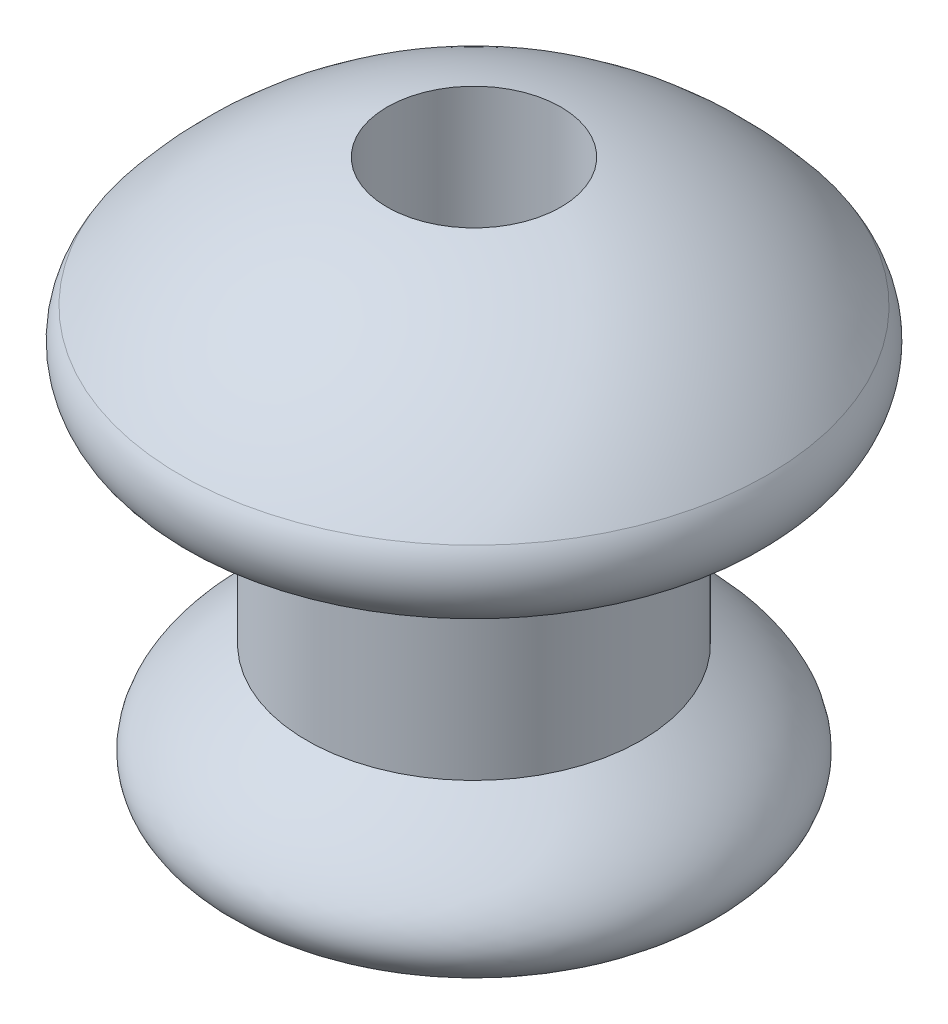
from build123d import *

# Parameters (mm, degrees)
SKETCH2_R          = 1
CUT_EXTRUDE2_DEPTH = 9.513842467


with BuildPart() as part:
    # Sketch1 → Revolve1 (revolve)
    with BuildSketch(Plane.XY):
        with BuildLine():
            add(Edge.make_bspline(
                [(1.901469747, -4.187890833), (3.997803393, -5.505352851), (2.40138715, -6.003675185), (0.316595481, -6.158045679)],
                knots=[0, 0, 0, 0, 1, 1, 1, 1], degree=3))
            Line((1.901469747, -4.187890833), (1.901469747, -1.606934047))
            Line((1.901469747, -1.606934047), (3.270835138, -1.606934047))
            ThreePointArc((3.270835138, -1.606934047), (3.457066196, -1.22506293), (3.356353959, -0.812310458))
            ThreePointArc((3.356353959, -0.812310458), (3.314000681, -0.760487314), (3.270835138, -0.709338763))
            ThreePointArc((3.270835138, -0.709338763), (1.788504548, 0.399036147), (-0.024669059, 0.770789271))
            Line((-0.024669059, 0.770789271), (-0.024669059, -6.158045679))
            Line((-0.024669059, -6.158045679), (0.316595481, -6.158045679))
        make_face()
    revolve(axis=Axis((-0.024669059, -4.1454e-05, 0), (0, -1, 0)))

    # Sketch2 → Cut-Extrude2 (cut, through all)
    with BuildSketch(Plane(origin=(0, -6.158045679, 0), x_dir=(-1, 0, 0), z_dir=(0, -1, 0))):
        with Locations((0.024669059, 0)):
            Circle(SKETCH2_R)
    extrude(amount=-CUT_EXTRUDE2_DEPTH, mode=Mode.SUBTRACT)


solid = part.part
